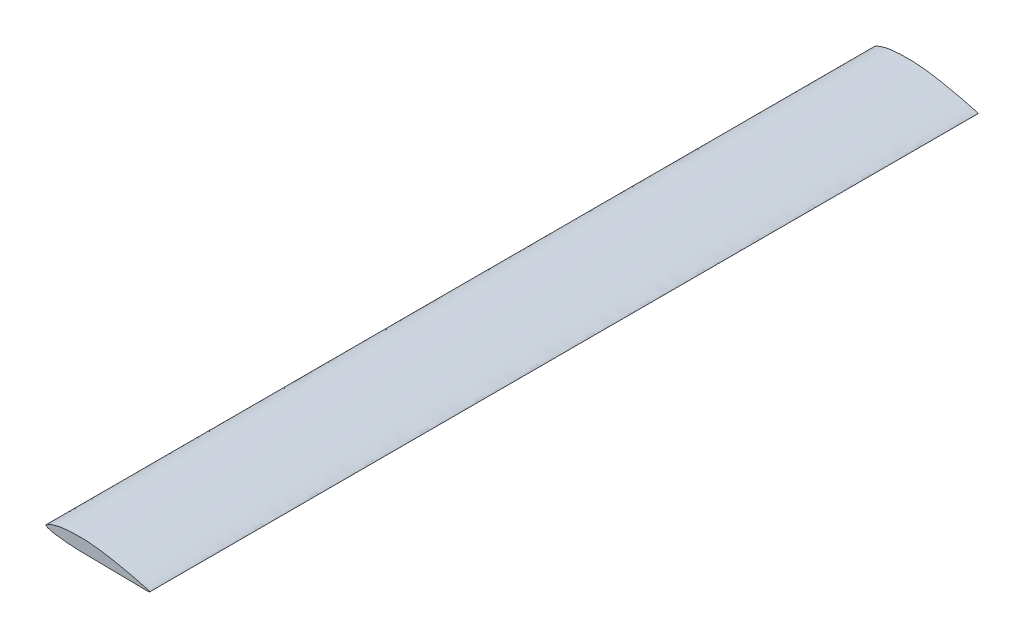
from build123d import *

# Parameters (mm, degrees)
BOSS_EXTRUDE1_DEPTH      = 800
BOSS_EXTRUDE1_DEPTH_BACK = 800


with BuildPart() as part:
    # Sketch1 → Boss-Extrude1 (new, two sides: drawn at the far end of the back side and taken through both)
    with BuildSketch(Plane.XY.offset(-BOSS_EXTRUDE1_DEPTH_BACK)):
        with BuildLine():
            add(Edge.make_bspline(
                [(-65.862614777, 69.224075689), (-67.556883923, 72.003565006), (-44.362424494, 80.286451806), (-26.873888152, 82.244447814), (1.21583298, 83.750678394), (28.553220326, 81.957863084), (56.120321575, 77.821263703), (85.328168176, 71.63318079), (105.095596541, 67.394078381), (144.966284619, 57.160625882), (98.46900743, 58.151369471), (70.612897037, 58.354083886), (27.023673336, 59.336570503), (-6.716429442, 59.179901034), (-34.977762924, 61.632387723), (-52.842470304, 63.995741015), (-64.962508724, 67.747430042), (-65.862614777, 69.224075689)],
                knots=[0, 0, 0, 0, 0.043727471, 0.104026486, 0.168347349, 0.238957045, 0.308436998, 0.376503697, 0.446312979, 0.505134168, 0.544245207, 0.67715746, 0.778293672, 0.847506813, 0.93182758, 0.976769121, 1, 1, 1, 1], degree=3))
        make_face()
    extrude(amount=BOSS_EXTRUDE1_DEPTH + BOSS_EXTRUDE1_DEPTH_BACK)


solid = part.part
